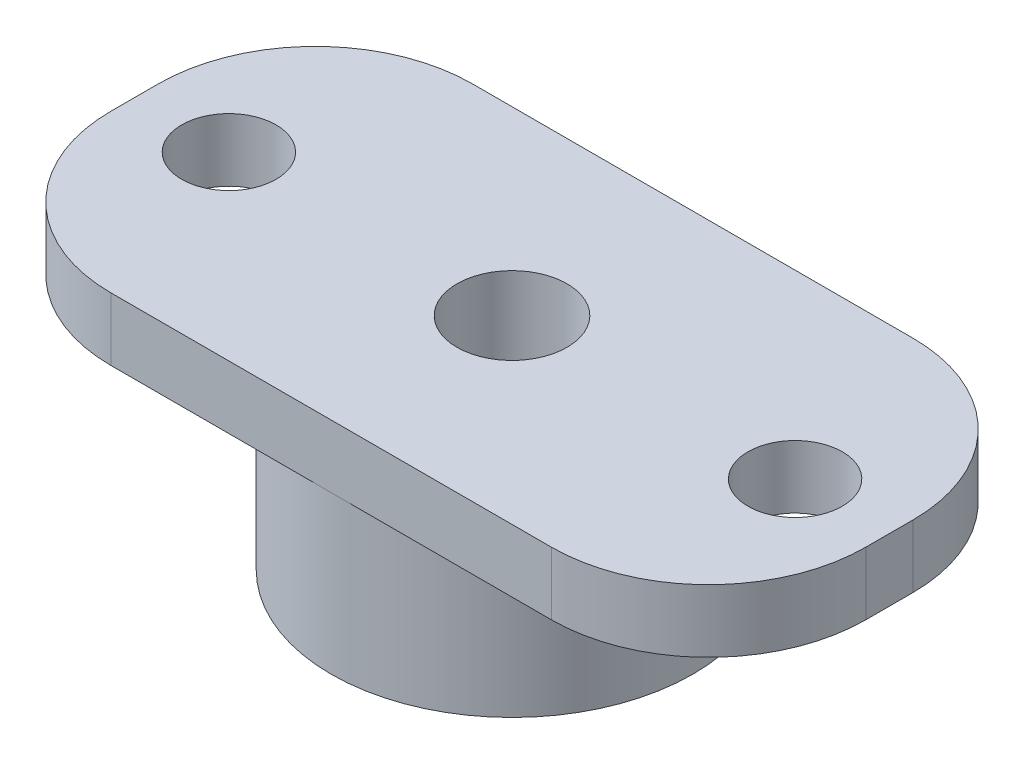
from build123d import *

# Parameters (mm, degrees)
SKETCH_1_R          = 5.75
SKETCH_1_R_2        = 1.75
EXTRUDE_1_DEPTH     = 7
SKETCH_1_20_R       = 3.1
CUT_EXTRUDE_1_DEPTH = 2.6
EXTRUDE_START       = 5
SKETCH_1_21_W       = 24
SKETCH_1_21_H       = 11.5
SKETCH_1_21_R       = 1.75
EXTRUDE_2_DEPTH     = 2
SKETCH_2_R          = 1.5
CUT_EXTRUDE_2_DEPTH = 15.214868976
FILLET_1_R          = 5


with BuildPart() as part:
    # 草图1 → 凸台-拉伸1 (new body)
    with BuildSketch(Plane(origin=(0, 0, 0), x_dir=(1, 0, 0), z_dir=(0, 1, 0))):
        with Locations(Location((0, 0, 0), (0, 0, 270))):
            Circle(SKETCH_1_R)
        with Locations(Location((0, 0, 0), (0, 0, 270))):
            Circle(SKETCH_1_R_2, mode=Mode.SUBTRACT)
    extrude(amount=EXTRUDE_1_DEPTH)

    # 草图1<20> → 切除-拉伸1 (cut)
    with BuildSketch(Plane(origin=(0, 0, 0), x_dir=(1, 0, 0), z_dir=(0, 1, 0))):
        with Locations(Location((0, 0, 0), (0, 0, 270))):
            Circle(SKETCH_1_20_R)
    extrude(amount=CUT_EXTRUDE_1_DEPTH, mode=Mode.SUBTRACT)

    # 草图1<21> → 凸台-拉伸2 (add)
    with BuildSketch(Plane(origin=(0, 0, 0), x_dir=(1, 0, 0), z_dir=(0, 1, 0)).offset(EXTRUDE_START)):
        Rectangle(SKETCH_1_21_W, SKETCH_1_21_H)
        with Locations(Location((0, 0, 0), (0, 0, 270))):
            Circle(SKETCH_1_21_R, mode=Mode.SUBTRACT)
    extrude(amount=EXTRUDE_2_DEPTH)

    # 草图2 → 切除-拉伸2 (cut, through all)
    with BuildSketch(Plane.XZ.offset(-5)):
        with Locations(Location((-9, 0, 0), (0, 0, 270))):
            Circle(SKETCH_2_R)
        with Locations(Location((9, 0, 0), (0, 0, 270))):
            Circle(SKETCH_2_R)
    extrude(amount=-CUT_EXTRUDE_2_DEPTH, mode=Mode.SUBTRACT)

    # 圆角1
    fillet_1_edges = [part.edges().sort_by_distance(p)[0] for p in [
        (12, 6, 5.75),
        (-12, 6, 5.75),
        (-12, 6, -5.75),
        (12, 6, -5.75),
    ]]
    fillet(fillet_1_edges, radius=FILLET_1_R)


solid = part.part
